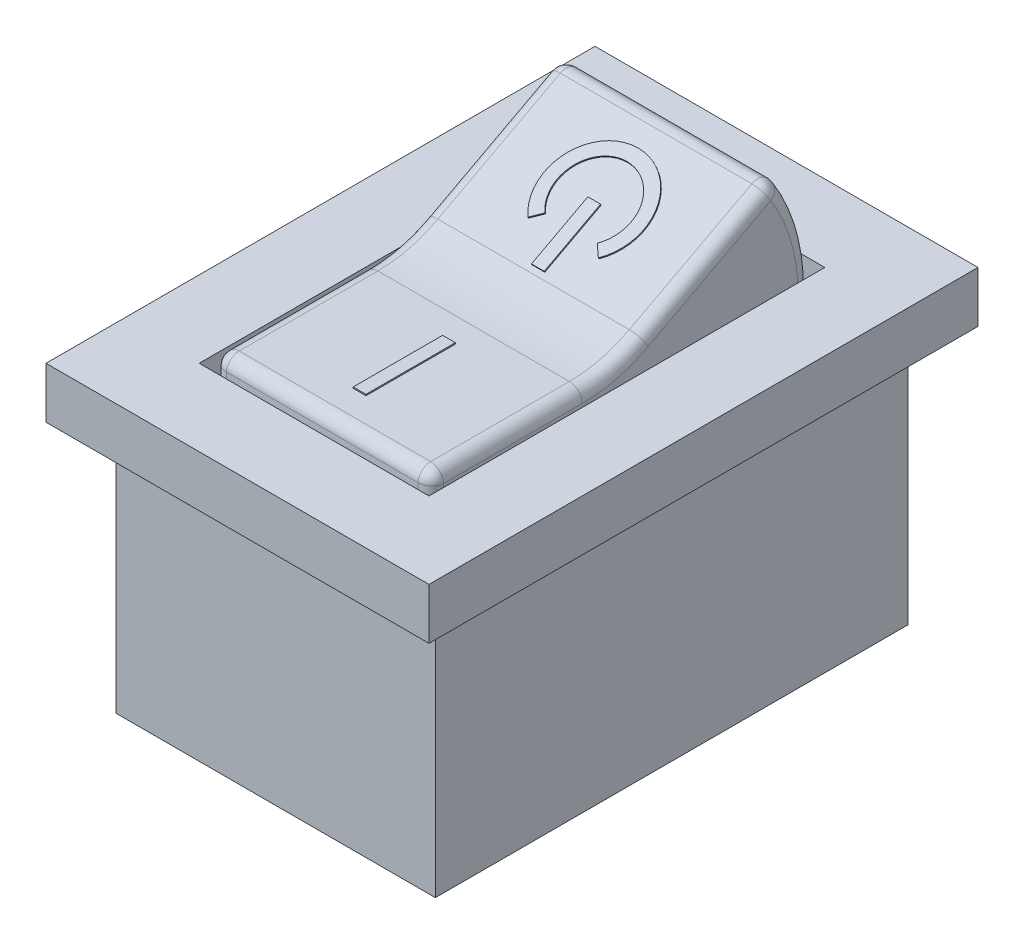
from build123d import *

# Parameters (mm, degrees)
SKETCH1_W           = 12.5
SKETCH1_H           = 18.5
BOSS_EXTRUDE1_DEPTH = 10
SKETCH2_W           = 15
SKETCH2_H           = 21.5
BOSS_EXTRUDE2_DEPTH = 2
SKETCH3_W           = 9
SKETCH3_H           = 15.5
CUT_EXTRUDE1_DEPTH  = 11
BOSS_EXTRUDE3_DEPTH = 4.25
FILLET1_R           = 5
FILLET2_R           = 0.5
SKETCH6_W           = 0.5
SKETCH6_H           = 3.5
BOSS_EXTRUDE4_DEPTH = 0.05
SKETCH7_W           = 0.5
SKETCH7_H           = 2.5
BOSS_EXTRUDE5_DEPTH = 0.05


with BuildPart() as part:
    # Sketch1 → Boss-Extrude1 (new body)
    with BuildSketch(Plane(origin=(0, 0, 0), x_dir=(1, 0, 0), z_dir=(0, 1, 0))):
        Rectangle(SKETCH1_W, SKETCH1_H)
    extrude(amount=-BOSS_EXTRUDE1_DEPTH)

    # Sketch2 → Boss-Extrude2 (add)
    with BuildSketch(Plane(origin=(0, 0, 0), x_dir=(1, 0, 0), z_dir=(0, 1, 0))):
        Rectangle(SKETCH2_W, SKETCH2_H)
    extrude(amount=BOSS_EXTRUDE2_DEPTH)

    # Sketch3 → Cut-Extrude1 (cut)
    with BuildSketch(Plane(origin=(0, 2, 0), x_dir=(1, 0, 0), z_dir=(0, 1, 0))):
        Rectangle(SKETCH3_W, SKETCH3_H)
    extrude(amount=-CUT_EXTRUDE1_DEPTH, mode=Mode.SUBTRACT)


with BuildPart() as body_2:
    # Sketch4 → Boss-Extrude3 (new, symmetric)
    with BuildSketch(Plane(origin=(0, 0, 0), x_dir=(0, 0, -1), z_dir=(1, 0, 0))):
        with BuildLine():
            Line((-7.383950938, 2.382654215), (-0.25550292, 2.382654215))
            Line((-0.25550292, 2.382654215), (6.03909208, 5.728225159))
            ThreePointArc((6.03909208, 5.728225159), (1.802878967, -5.875950696), (-7.383950938, 2.382654215))
        make_face()
    extrude(amount=BOSS_EXTRUDE3_DEPTH, both=True)

    # Fillet1
    fillet1_edges = [body_2.edges().sort_by_distance(p)[0] for p in [
        (0, 2.382654215, 0.25550292),
    ]]
    fillet(fillet1_edges, radius=FILLET1_R)

    # Fillet2
    fillet2_edges = [body_2.edges().sort_by_distance(p)[0] for p in [
        (-4.25, 2.382654215, 4.442829109),
        (4.25, 2.382654215, 4.442829109),
        (-4.25, 2.531076372, 0.292495788),
        (4.25, 2.531076372, 0.292495788),
        (4.25, -5.875950696, -1.802878967),
        (-4.25, 4.347878173, -3.442009136),
        (-4.25, -5.875950696, -1.802878967),
        (0, 2.382654215, 7.383950938),
        (0, 5.728225159, -6.03909208),
        (4.25, 4.347878173, -3.442009136),
    ]]
    fillet(fillet2_edges, radius=FILLET2_R)

    # Sketch6 → Boss-Extrude4 (add)
    with BuildSketch(Plane(origin=(0, 2.382654215, 0), x_dir=(1, 0, 0), z_dir=(0, 1, 0))):
        with Locations((0, -4.218312539)):
            Rectangle(SKETCH6_W, SKETCH6_H)
    extrude(amount=BOSS_EXTRUDE4_DEPTH)

    # Sketch7 → Boss-Extrude5 (add)
    with BuildSketch(Plane(origin=(0, 1.963720132, 1.043715285), x_dir=(1, 0, 0), z_dir=(0, 0.8830246056114482, 0.4693266941957877))):
        with BuildLine():
            Line((-1.026667717, 3.828769763), (-1.380221108, 3.475216372))
            ThreePointArc((-1.380221108, 3.475216372), (0, 6.80736489), (1.380221108, 3.475216372))
            Line((1.380221108, 3.475216372), (1.026667717, 3.828769763))
            ThreePointArc((1.026667717, 3.828769763), (0, 6.30736489), (-1.026667717, 3.828769763))
        make_face()
        with Locations((0, 3.60543748)):
            Rectangle(SKETCH7_W, SKETCH7_H)
    extrude(amount=BOSS_EXTRUDE5_DEPTH)


solid = Compound([part.part, body_2.part])
